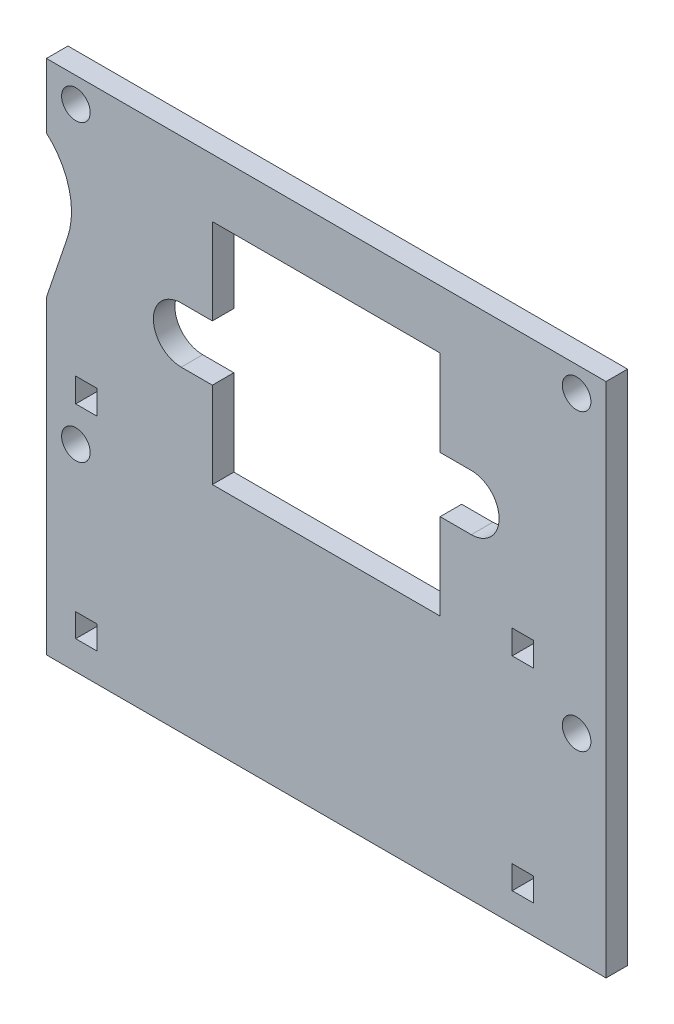
from build123d import *

# Parameters (mm, degrees)
SKETCH1_W           = 1.5875
SKETCH1_H           = 1.7272
SKETCH1_R           = 1.0541
SKETCH1_H_2         = 1.778
BOSS_EXTRUDE1_DEPTH = 1.5875


with BuildPart() as part:
    # Sketch1 → Boss-Extrude1 (new body)
    with BuildSketch(Plane.XY):
        with BuildLine():
            Line((-20.6375, 22.848075056), (-20.6375, 0))
            Line((-20.6375, 0), (20.6375, 0))
            Line((20.6375, 0), (20.6375, 38.1))
            Line((20.6375, 38.1), (-20.6375, 38.1))
            Line((-20.6375, 38.1), (-20.6375, 33.337040193))
            ThreePointArc((-20.6375, 33.337040193), (-18.972227818, 30.628064614), (-19.079863508, 27.45))
            Line((-19.079863508, 27.45), (-20.6375, 22.848075056))
        make_face()
        with Locations((-17.68475, 2.977543878)):
            Rectangle(SKETCH1_W, SKETCH1_H, mode=Mode.SUBTRACT)
        with Locations((-18.4658, 14.5415)):
            Circle(SKETCH1_R, mode=Mode.SUBTRACT)
        with Locations((-17.68475, 18.002943878)):
            Rectangle(SKETCH1_W, SKETCH1_H_2, mode=Mode.SUBTRACT)
        with Locations((14.50975, 2.977543878)):
            Rectangle(SKETCH1_W, SKETCH1_H, mode=Mode.SUBTRACT)
        with Locations((14.50975, 18.002943878)):
            Rectangle(SKETCH1_W, SKETCH1_H_2, mode=Mode.SUBTRACT)
        with Locations((18.4658, 14.5415)):
            Circle(SKETCH1_R, mode=Mode.SUBTRACT)
        with BuildLine():
            Line((-8.4, 17), (-8.4, 23.35))
            Line((-8.4, 23.35), (-10.7, 23.35))
            ThreePointArc((-10.7, 23.35), (-12.75, 25.4), (-10.7, 27.45))
            Line((-10.7, 27.45), (-8.4, 27.45))
            Line((-8.4, 27.45), (-8.4, 33.8))
            Line((-8.4, 33.8), (8.4, 33.8))
            Line((8.4, 33.8), (8.4, 27.45))
            Line((8.4, 27.45), (10.7, 27.45))
            ThreePointArc((10.7, 27.45), (12.75, 25.4), (10.7, 23.35))
            Line((10.7, 23.35), (8.4, 23.35))
            Line((8.4, 23.35), (8.4, 17))
            Line((8.4, 17), (-8.4, 17))
        make_face(mode=Mode.SUBTRACT)
        with Locations((-18.4658, 36.2585)):
            Circle(SKETCH1_R, mode=Mode.SUBTRACT)
        with Locations((18.4658, 36.2585)):
            Circle(SKETCH1_R, mode=Mode.SUBTRACT)
    extrude(amount=BOSS_EXTRUDE1_DEPTH)


solid = part.part
